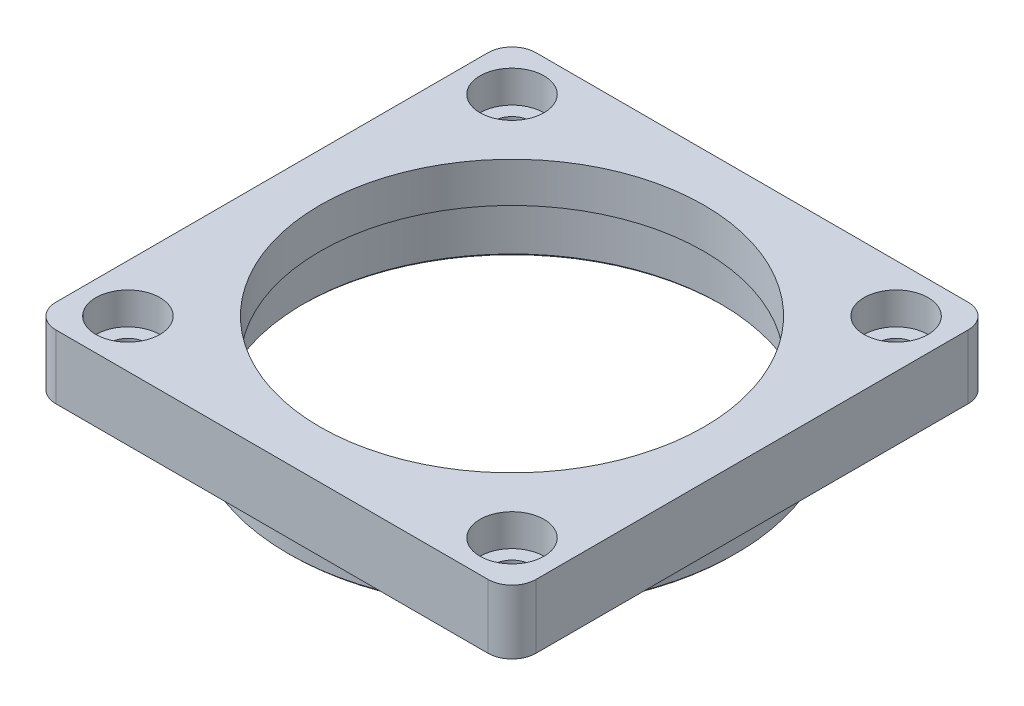
from build123d import *

# Parameters (mm, degrees)
SKETCH_1_W          = 60
SKETCH_1_H          = 60
SKETCH_1_R          = 24
EXTRUDE_1_DEPTH     = 8
SKETCH_2_R          = 28
SKETCH_2_R_2        = 26
EXTRUDE_2_DEPTH     = 4
SKETCH_3_R          = 2.25
CUT_EXTRUDE_1_DEPTH = 44.17406629
FILLET_1_R          = 3
SKETCH_4_R          = 26.05
CUT_EXTRUDE_2_DEPTH = 7
SKETCH_5_R          = 4
CUT_EXTRUDE_3_DEPTH = 4
CHAMFER_1_SIZE      = 0.3


with BuildPart() as part:
    # Эскиз1 → Бобышка-Вытянуть1 (new body)
    with BuildSketch(Plane(origin=(0, 0, 0), x_dir=(1, 0, 0), z_dir=(0, 1, 0))):
        Rectangle(SKETCH_1_W, SKETCH_1_H)
        with Locations(Location((0, 0, 0), (0, 0, 270))):
            Circle(SKETCH_1_R, mode=Mode.SUBTRACT)
    extrude(amount=EXTRUDE_1_DEPTH)

    # Эскиз2 → Бобышка-Вытянуть2 (add)
    with BuildSketch(Plane.XZ):
        with Locations(Location((0, 0, 0), (0, 0, 270))):
            Circle(SKETCH_2_R)
        with Locations(Location((0, 0, 0), (0, 0, 270))):
            Circle(SKETCH_2_R_2, mode=Mode.SUBTRACT)
    extrude(amount=EXTRUDE_2_DEPTH)

    # Эскиз3 → Вырез-Вытянуть1 (cut, through all)
    with BuildSketch(Plane(origin=(0, 0, 0), x_dir=(-1, 0, 0), z_dir=(0, -1, 0))):
        with Locations(Location((24, -24, 0), (0, 0, 90))):
            Circle(SKETCH_3_R)
        with Locations(Location((-24, -24, 0), (0, 0, 90))):
            Circle(SKETCH_3_R)
        with Locations(Location((-24, 24, 0), (0, 0, 90))):
            Circle(SKETCH_3_R)
        with Locations(Location((24, 24, 0), (0, 0, 90))):
            Circle(SKETCH_3_R)
    extrude(amount=-CUT_EXTRUDE_1_DEPTH, mode=Mode.SUBTRACT)

    # Скругление1
    fillet_1_edges = [part.edges().sort_by_distance(p)[0] for p in [
        (30, 4, 30),
        (-30, 4, 30),
        (-30, 4, -30),
        (30, 4, -30),
    ]]
    fillet(fillet_1_edges, radius=FILLET_1_R)

    # Эскиз4 → Вырез-Вытянуть2 (cut)
    with BuildSketch(Plane.XZ.offset(4)):
        with Locations(Location((0, 0, 0), (0, 0, 270))):
            Circle(SKETCH_4_R)
    extrude(amount=-CUT_EXTRUDE_2_DEPTH, mode=Mode.SUBTRACT)

    # Эскиз5 → Вырез-Вытянуть3 (cut)
    with BuildSketch(Plane(origin=(0, 8, 0), x_dir=(1, 0, 0), z_dir=(0, 1, 0))):
        with Locations(Location((-24, 24, 0), (0, 0, 270))):
            Circle(SKETCH_5_R)
        with Locations(Location((24, 24, 0), (0, 0, 270))):
            Circle(SKETCH_5_R)
        with Locations(Location((24, -24, 0), (0, 0, 270))):
            Circle(SKETCH_5_R)
        with Locations(Location((-24, -24, 0), (0, 0, 270))):
            Circle(SKETCH_5_R)
    extrude(amount=-CUT_EXTRUDE_3_DEPTH, mode=Mode.SUBTRACT)

    # Фаска1
    chamfer_1_edges = [part.edges().sort_by_distance(p)[0] for p in [
        (0, -4, 28),
        (0, -4, 26.05),
    ]]
    chamfer(chamfer_1_edges, length=CHAMFER_1_SIZE)


solid = part.part
